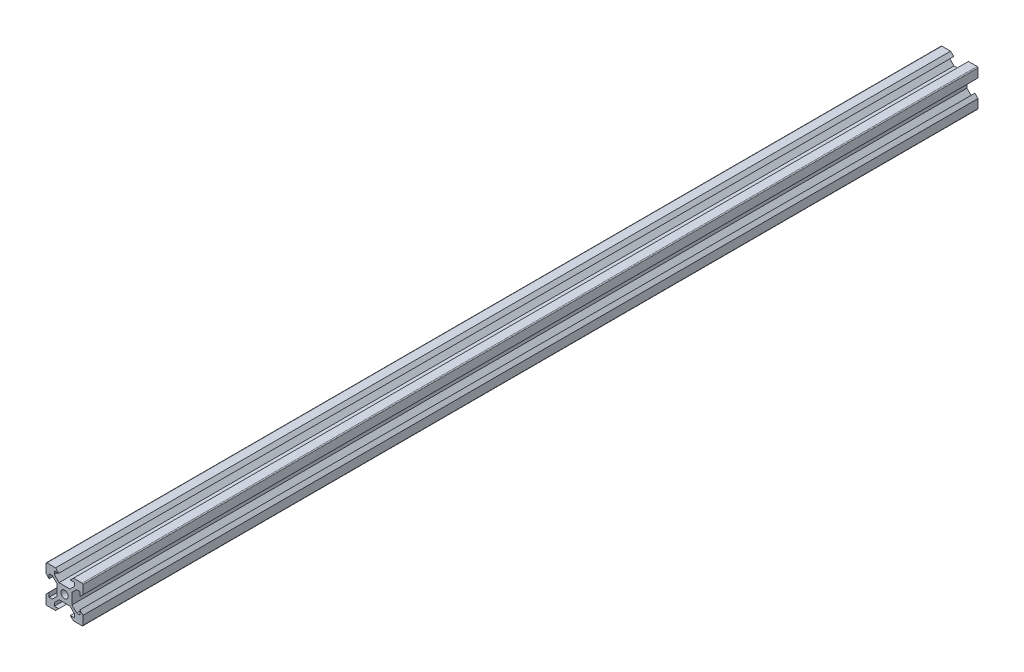
from build123d import *

# Parameters (mm, degrees)
CROQUIS1_R              = 2
SALIENTE_EXTRUIR2_DEPTH = 242


with BuildPart() as part:
    # Croquis1 → Saliente-Extruir2 (new, symmetric)
    with BuildSketch(Plane.XY):
        with BuildLine():
            Line((-4.825, 10), (-3.125, 8.3))
            Line((-3.125, 8.3), (-5.5, 8.3))
            Line((-5.5, 8.3), (-5.5, 6.560660172))
            Line((-5.5, 6.560660172), (-2.939339828, 4))
            Line((-2.939339828, 4), (2.939339828, 4))
            Line((2.939339828, 4), (5.5, 6.560660172))
            Line((5.5, 6.560660172), (5.5, 8.3))
            Line((5.5, 8.3), (3.125, 8.3))
            Line((3.125, 8.3), (4.825, 10))
            Line((4.825, 10), (9.5, 10))
            ThreePointArc((9.5, 10), (9.853553391, 9.853553391), (10, 9.5))
            Line((10, 9.5), (10, 4.825))
            Line((10, 4.825), (8.3, 3.125))
            Line((8.3, 3.125), (8.3, 5.5))
            Line((8.3, 5.5), (6.560660172, 5.5))
            Line((6.560660172, 5.5), (4, 2.939339828))
            Line((4, 2.939339828), (4, -2.939339828))
            Line((4, -2.939339828), (6.560660172, -5.5))
            Line((6.560660172, -5.5), (8.3, -5.5))
            Line((8.3, -5.5), (8.3, -3.125))
            Line((8.3, -3.125), (10, -4.825))
            Line((10, -4.825), (10, -9.5))
            ThreePointArc((10, -9.5), (9.853553391, -9.853553391), (9.5, -10))
            Line((9.5, -10), (4.825, -10))
            Line((4.825, -10), (3.125, -8.3))
            Line((3.125, -8.3), (5.5, -8.3))
            Line((5.5, -8.3), (5.5, -6.560660172))
            Line((5.5, -6.560660172), (2.939339828, -4))
            Line((2.939339828, -4), (-2.939339828, -4))
            Line((-2.939339828, -4), (-5.5, -6.560660172))
            Line((-5.5, -6.560660172), (-5.5, -8.3))
            Line((-5.5, -8.3), (-3.125, -8.3))
            Line((-3.125, -8.3), (-4.825, -10))
            Line((-4.825, -10), (-9.5, -10))
            ThreePointArc((-9.5, -10), (-9.853553391, -9.853553391), (-10, -9.5))
            Line((-10, -9.5), (-10, -4.825))
            Line((-10, -4.825), (-8.3, -3.125))
            Line((-8.3, -3.125), (-8.3, -5.5))
            Line((-8.3, -5.5), (-6.560660172, -5.5))
            Line((-6.560660172, -5.5), (-4, -2.939339828))
            Line((-4, -2.939339828), (-4, 2.939339828))
            Line((-4, 2.939339828), (-6.560660172, 5.5))
            Line((-6.560660172, 5.5), (-8.3, 5.5))
            Line((-8.3, 5.5), (-8.3, 3.125))
            Line((-8.3, 3.125), (-10, 4.825))
            Line((-10, 4.825), (-10, 9.5))
            ThreePointArc((-10, 9.5), (-9.853553391, 9.853553391), (-9.5, 10))
            Line((-9.5, 10), (-4.825, 10))
        make_face()
        Circle(CROQUIS1_R, mode=Mode.SUBTRACT)
    extrude(amount=SALIENTE_EXTRUIR2_DEPTH, both=True)


solid = part.part
